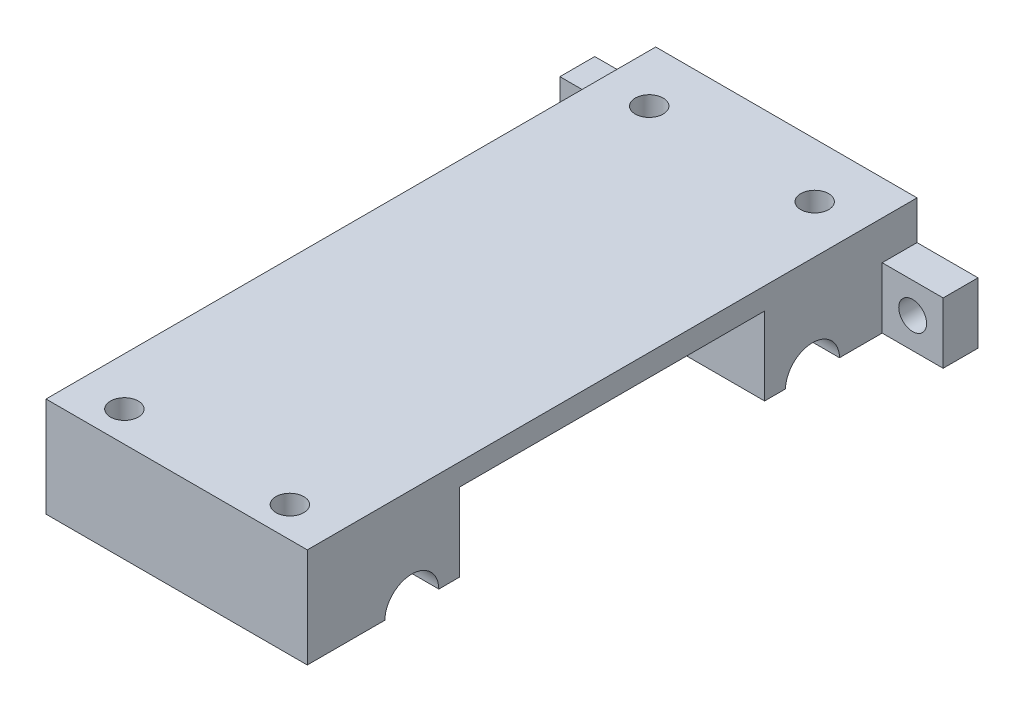
from build123d import *

# Parameters (mm, degrees)
BOSS_EXTRUDE2_DEPTH      = 10.5
BOSS_EXTRUDE2_DEPTH_BACK = 0.95
SKETCH3_W                = 30
SKETCH3_H                = 70
SKETCH4_W                = 30
SKETCH4_H                = 35
CUT_EXTRUDE2_DEPTH       = 8.95
SKETCH5_R                = 3.1
CUT_EXTRUDE3_DEPTH       = 48.2784306
SKETCH6_R                = 1.6
CUT_EXTRUDE4_DEPTH       = 40.763079609
SKETCH7_W                = 7
SKETCH7_H                = 7
SKETCH7_R                = 1.6
SKETCH7_R_2              = 1.525130212
BOSS_EXTRUDE3_DEPTH      = 4


with BuildPart() as part:
    # Sketch3 → Boss-Extrude2 (new, two sides: drawn at the far end of the back side and taken through both)
    with BuildSketch(Plane(origin=(0, 0, 0), x_dir=(1, 0, 0), z_dir=(0, 1, 0)).offset(-BOSS_EXTRUDE2_DEPTH_BACK)):
        Rectangle(SKETCH3_W, SKETCH3_H)
    extrude(amount=BOSS_EXTRUDE2_DEPTH + BOSS_EXTRUDE2_DEPTH_BACK)

    # Sketch4 → Cut-Extrude2 (cut)
    with BuildSketch(Plane.XZ.offset(0.95)):
        Rectangle(SKETCH4_W, SKETCH4_H)
    extrude(amount=-CUT_EXTRUDE2_DEPTH, mode=Mode.SUBTRACT)

    # Sketch5 → Cut-Extrude3 (cut, through all)
    with BuildSketch(Plane.ZY.offset(15)):
        with Locations((-23, -1)):
            Circle(SKETCH5_R)
        with Locations((23, -1)):
            Circle(SKETCH5_R)
    extrude(amount=-CUT_EXTRUDE3_DEPTH, mode=Mode.SUBTRACT)

    # Sketch6 → Cut-Extrude4 (cut, through all)
    with BuildSketch(Plane(origin=(0, 10.5, 0), x_dir=(1, 0, 0), z_dir=(0, 1, 0))):
        with Locations(Location((-9.5, 28.75, 0), (0, 0, 270))):
            Circle(SKETCH6_R)
        with Locations(Location((9.5, 28.75, 0), (0, 0, 270))):
            Circle(SKETCH6_R)
        with Locations(Location((-9.5, -31.5, 0), (0, 0, 270))):
            Circle(SKETCH6_R)
        with Locations(Location((9.5, -31.5, 0), (0, 0, 270))):
            Circle(SKETCH6_R)
    extrude(amount=-CUT_EXTRUDE4_DEPTH, mode=Mode.SUBTRACT)

    # Sketch7 → Boss-Extrude3 (add)
    # profile 1 of 2: a face of its own
    with BuildSketch(Plane(origin=(0, 0, -35), x_dir=(-1, 0, 0), z_dir=(0, 0, -1))):
        with Locations((-18.5, 2.55)):
            Rectangle(SKETCH7_W, SKETCH7_H)
        with Locations((-18.5, 2.55)):
            Circle(SKETCH7_R, mode=Mode.SUBTRACT)
    # profile 2 of 2: a face of its own
    with BuildSketch(Plane(origin=(0, 0, -35), x_dir=(-1, 0, 0), z_dir=(0, 0, -1))):
        with Locations((18.5, 2.55)):
            Rectangle(SKETCH7_W, SKETCH7_H)
        with Locations((18.5, 2.55)):
            Circle(SKETCH7_R_2, mode=Mode.SUBTRACT)
    extrude(amount=-BOSS_EXTRUDE3_DEPTH)


solid = part.part
